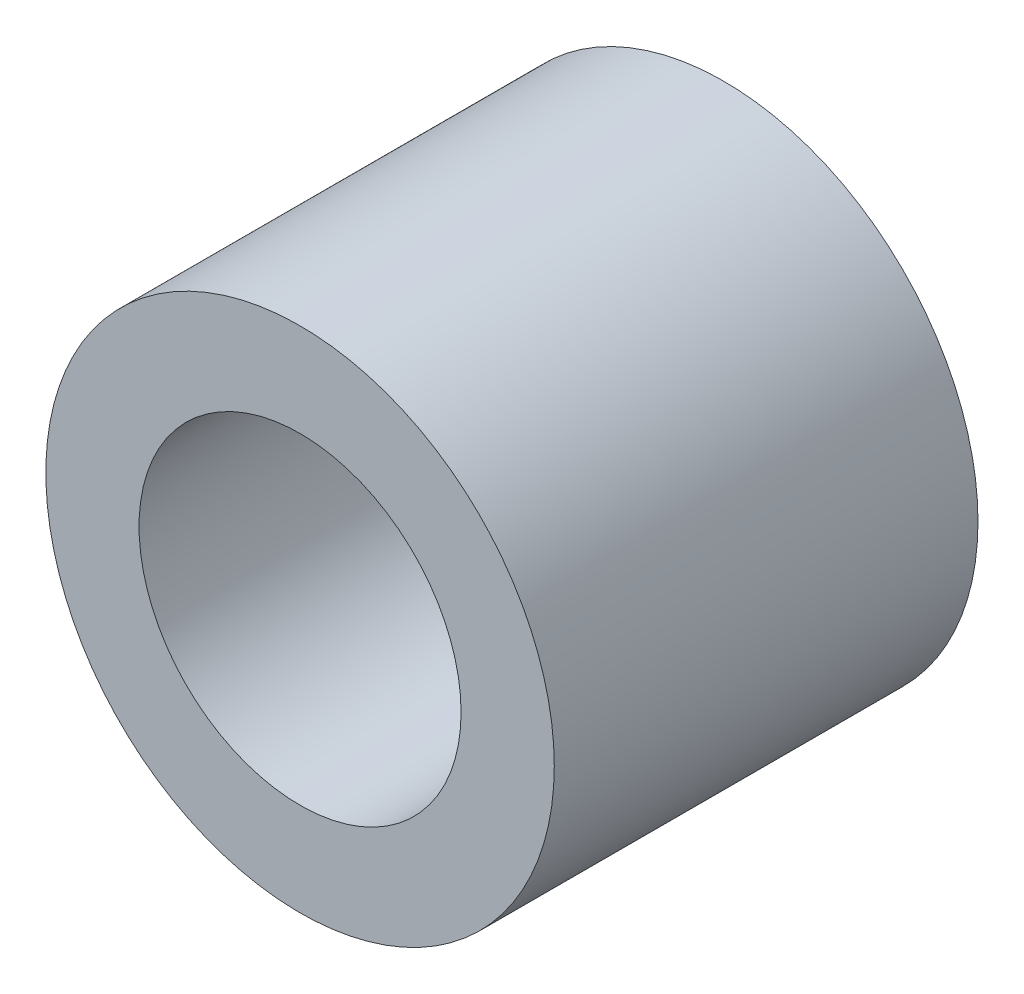
from build123d import *

# Parameters (mm, degrees)
SKETCH_1_R      = 3
SKETCH_1_R_2    = 1.9
EXTRUDE_1_DEPTH = 5


with BuildPart() as part:
    # ｽｹｯﾁ1 → ﾎﾞｽ - 押し出し1 (new body)
    with BuildSketch(Plane.XY):
        Circle(SKETCH_1_R)
        Circle(SKETCH_1_R_2, mode=Mode.SUBTRACT)
    extrude(amount=EXTRUDE_1_DEPTH)


solid = part.part
